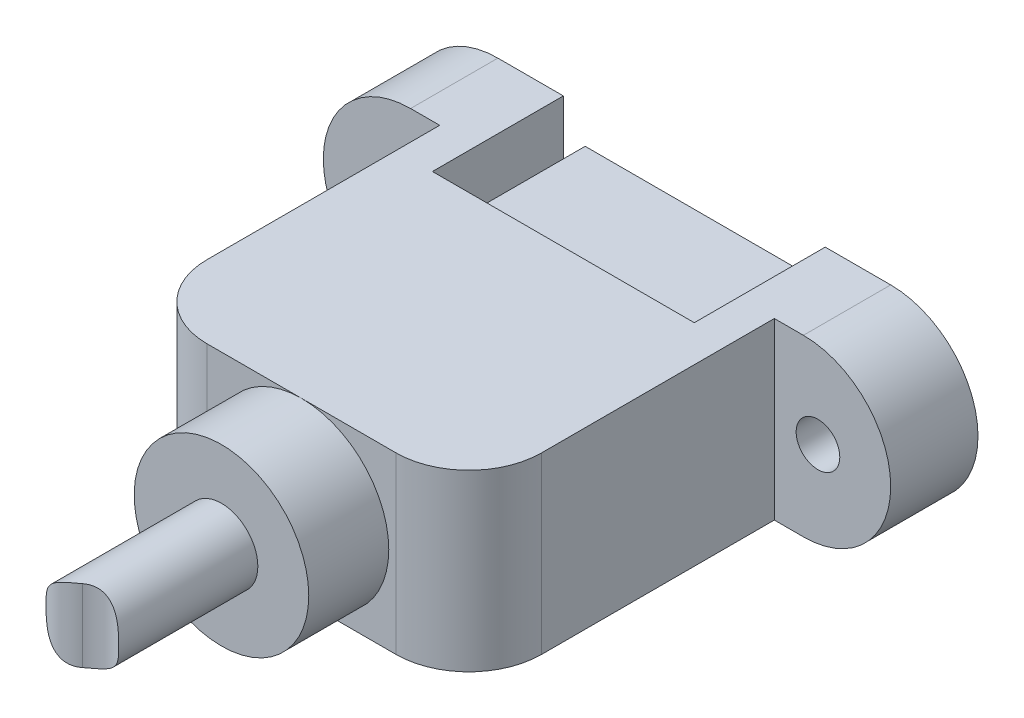
from build123d import *

# Parameters (mm, degrees)
P_IDAT_VYSUNUT_M1_DEPTH       = 6
SKICA2_W                      = 2.5
SKICA2_H                      = 12
P_IDAT_VYSUNUT_M2_DEPTH       = 9
SKICA3_R                      = 1.5
P_IDAT_VYSUNUT_M3_DEPTH       = 6
SKICA5_R                      = 6
P_IDAT_VYSUNUT_M4_DEPTH       = 5.5
SKICA6_W                      = 15
SKICA6_H                      = 7.5
SKICA6_W_2                    = 13
SKICA6_H_2                    = 5.5
P_IDAT_VYSUNUT_M5_DEPTH       = 9
SKICA7_W                      = 11
SKICA7_H                      = 2
P_IDAT_VYSUNUT_M7_DEPTH       = 9
SKICA8_R                      = 2.5
P_IDAT_VYSUNUT_M8_DEPTH       = 10
ODEBRAT_VYSUNUT_M2_DEPTH      = 40.223717315
ODEBRAT_VYSUNUT_M2_DEPTH_BACK = 40.223717315


with BuildPart() as part:
    # Skica1 → Přidat vysunutím1 (new, symmetric)
    with BuildSketch(Plane(origin=(0, 0, 0), x_dir=(1, 0, 0), z_dir=(0, 1, 0))):
        with BuildLine():
            Line((-11.5, 0), (11.5, 0))
            Line((11.5, 0), (11.5, -13))
            ThreePointArc((11.5, -13), (10.035533906, -16.535533906), (6.5, -18))
            Line((6.5, -18), (-6.5, -18))
            ThreePointArc((-6.5, -18), (-10.035533906, -16.535533906), (-11.5, -13))
            Line((-11.5, -13), (-11.5, 0))
        make_face()
    extrude(amount=P_IDAT_VYSUNUT_M1_DEPTH, both=True)

    # Skica2 → Přidat vysunutím2 (add)
    with BuildSketch(Plane(origin=(0, 0, 0), x_dir=(-1, 0, 0), z_dir=(0, 0, -1))):
        with Locations((10.25, 0)):
            Rectangle(SKICA2_W, SKICA2_H)
        with Locations((-10.25, 0)):
            Rectangle(SKICA2_W, SKICA2_H)
    extrude(amount=P_IDAT_VYSUNUT_M2_DEPTH)

    # Skica3 → Přidat vysunutím3 (add)
    # profile 1 of 2: a face of its own
    with BuildSketch(Plane(origin=(0, 0, -9), x_dir=(-1, 0, 0), z_dir=(0, 0, -1))):
        with BuildLine():
            Line((11.5, 6), (13.5, 6))
            ThreePointArc((13.5, 6), (19.5, 0), (13.5, -6))
            Line((13.5, -6), (11.5, -6))
            Line((11.5, -6), (11.5, 6))
        make_face()
        with Locations((14.5, 0)):
            Circle(SKICA3_R, mode=Mode.SUBTRACT)
    # profile 2 of 2: a face of its own
    with BuildSketch(Plane(origin=(0, 0, -9), x_dir=(-1, 0, 0), z_dir=(0, 0, -1))):
        with BuildLine():
            Line((-11.5, 6), (-11.5, -6))
            Line((-11.5, -6), (-13.5, -6))
            ThreePointArc((-13.5, -6), (-19.5, 0), (-13.5, 6))
            Line((-13.5, 6), (-11.5, 6))
        make_face()
        with Locations(Location((-14.5, 0, 0), (0, 0, 180))):
            Circle(SKICA3_R, mode=Mode.SUBTRACT)
    extrude(amount=-P_IDAT_VYSUNUT_M3_DEPTH)

    # Skica5 → Přidat vysunutím4 (add)
    with BuildSketch(Plane.XY.offset(18)):
        with Locations(Location((0, 0, 0), (0, 0, 270))):
            Circle(SKICA5_R)
    extrude(amount=P_IDAT_VYSUNUT_M4_DEPTH)

    # Skica8 → Přidat vysunutím8 (add)
    with BuildSketch(Plane.XY.offset(23.5)):
        Circle(SKICA8_R)
    extrude(amount=P_IDAT_VYSUNUT_M8_DEPTH)

    # Skica9 → Odebrat vysunutím2 (cut, two sides: drawn at the far end of the back side and taken through both)
    with BuildSketch(Plane(origin=(0, 0, 0), x_dir=(1, 0, 0), z_dir=(0, 1, 0)).offset(-ODEBRAT_VYSUNUT_M2_DEPTH_BACK)):
        with BuildLine():
            Line((-84.414613958, 32.522930014), (-2.5, -33.0612495))
            ThreePointArc((-2.5, -33.0612495), (-1.25, -33.5), (0, -33.0612495))
            ThreePointArc((0, -33.0612495), (1.25, -32.622498999), (2.5, -33.0612495))
            Line((2.5, -33.0612495), (84.414613958, -98.645429013))
            Line((84.414613958, -98.645429013), (-44.345076014, -264.37441431))
            Line((-44.345076014, -264.37441431), (-213.17430393, -133.206055283))
            Line((-213.17430393, -133.206055283), (-84.414613958, 32.522930014))
        make_face()
    extrude(amount=ODEBRAT_VYSUNUT_M2_DEPTH + ODEBRAT_VYSUNUT_M2_DEPTH_BACK, mode=Mode.SUBTRACT)


with BuildPart() as body_2:
    # Skica6 → Přidat vysunutím5 (new body)
    with BuildSketch(Plane(origin=(0, 0, 0), x_dir=(-1, 0, 0), z_dir=(0, 0, -1))):
        Rectangle(SKICA6_W, SKICA6_H)
        Rectangle(SKICA6_W_2, SKICA6_H_2, mode=Mode.SUBTRACT)
    extrude(amount=P_IDAT_VYSUNUT_M5_DEPTH)


with BuildPart() as body_3:
    # Skica7 → Přidat vysunutím7 (new body)
    with BuildSketch(Plane(origin=(0, 0, 0), x_dir=(-1, 0, 0), z_dir=(0, 0, -1))):
        with Locations((0, -0.75)):
            Rectangle(SKICA7_W, SKICA7_H)
    extrude(amount=P_IDAT_VYSUNUT_M7_DEPTH)


solid = Compound([part.part, body_2.part, body_3.part])
